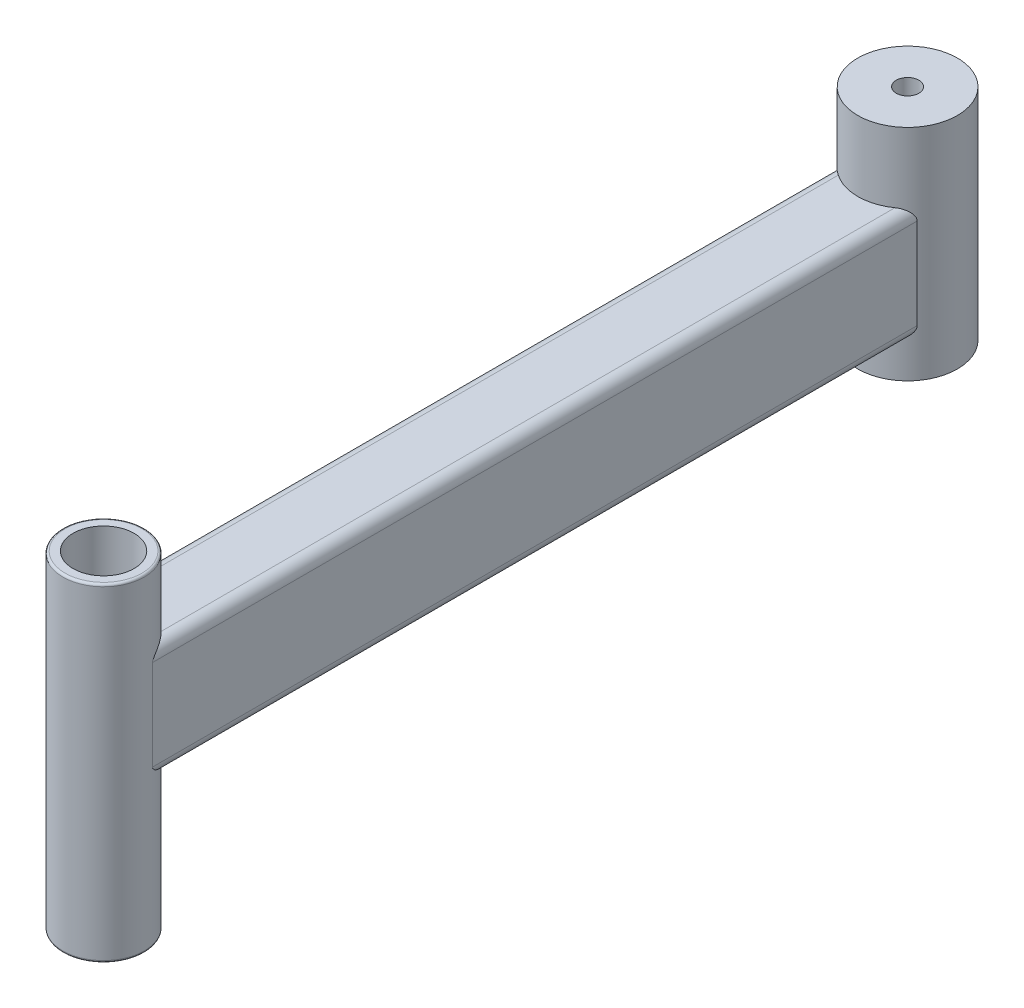
from build123d import *

# Parameters (mm, degrees)
SKETCH1_R                       = 22
BOSS_EXTRUDE1_DEPTH             = 97
SKETCH2_R                       = 5
CUT_EXTRUDE1_DEPTH              = 102.867561078
BOSS_EXTRUDE2_REACH             = 332.567
BOSS_EXTRUDE2_END_RADIUS        = 354
SKETCH6_W                       = 35
SKETCH6_H                       = 50
BOSS_EXTRUDE2_DIRECTION_2_DEPTH = 10
SKETCH7_R                       = 18
BOSS_EXTRUDE3_DEPTH             = 145
SKETCH8_R                       = 13.5
CUT_EXTRUDE2_DEPTH              = 401.960544509
FILLET1_R                       = 5
FILLET2_R                       = 1


with BuildPart() as part:
    # Sketch1 → Boss-Extrude1 (new body)
    with BuildSketch(Plane(origin=(0, 0, 0), x_dir=(1, 0, 0), z_dir=(0, 1, 0))):
        with Locations(Location((0, 0, 0), (0, 0, 270))):
            Circle(SKETCH1_R)
    extrude(amount=-BOSS_EXTRUDE1_DEPTH)

    # Sketch2 → Cut-Extrude1 (cut, through all)
    with BuildSketch(Plane(origin=(0, 0, 0), x_dir=(1, 0, 0), z_dir=(0, 1, 0))):
        with Locations(Location((0, 0, 0), (0, 0, 270))):
            Circle(SKETCH2_R)
    extrude(amount=-CUT_EXTRUDE1_DEPTH, mode=Mode.SUBTRACT)


with BuildPart() as body_2:
    # Boss-Extrude2: up to this cylinder (the profile starts inside it)
    boss_extrude2_end = Plane(origin=(0, -56, 0), z_dir=(0, 1, 0)) * Cylinder(BOSS_EXTRUDE2_END_RADIUS, 1374.134, mode=Mode.PRIVATE)
    # Sketch6 → Boss-Extrude2 (new, up to the surface)
    with BuildSketch(Plane.XY.offset(22), mode=Mode.PRIVATE) as boss_extrude2_sk1:
        with Locations((0, -56)):
            Rectangle(SKETCH6_W, SKETCH6_H)
    boss_extrude2_tool1 = extrude(boss_extrude2_sk1.sketch, amount=BOSS_EXTRUDE2_REACH, mode=Mode.PRIVATE) & boss_extrude2_end
    add(boss_extrude2_tool1.solids().sort_by_distance((0, -56, 22))[0])

    # Sketch6 → Boss-Extrude2 direction 2 (add)
    with BuildSketch(Plane.XY.offset(22)):
        with Locations((0, -56)):
            Rectangle(SKETCH6_W, SKETCH6_H)
    extrude(amount=-BOSS_EXTRUDE2_DIRECTION_2_DEPTH)


with BuildPart() as body_3:
    # Sketch7 → Boss-Extrude3 (new body)
    with BuildSketch(Plane(origin=(0, 0, 0), x_dir=(1, 0, 0), z_dir=(0, 1, 0))):
        with Locations(Location((0, -355.176041906, 0), (0, 0, 270))):
            Circle(SKETCH7_R)
    extrude(amount=-BOSS_EXTRUDE3_DEPTH)


with BuildPart() as cut_extrude2_tool:
    # Sketch8 → Cut-Extrude2 (new, through all)
    with BuildSketch(Plane(origin=(0, 0, 0), x_dir=(1, 0, 0), z_dir=(0, 1, 0))):
        with Locations(Location((0, -355.176041906, 0), (0, 0, 270))):
            Circle(SKETCH8_R)
    extrude(amount=-CUT_EXTRUDE2_DEPTH)


with BuildPart() as body_2_1:
    add(body_2.part)

    # Cut-Extrude2: cut by cut_extrude2_tool
    add(cut_extrude2_tool.part, mode=Mode.SUBTRACT)

    # Fillet1
    fillet1_edges = [body_2_1.edges().sort_by_distance(p)[0] for p in [
        (-17.5, -81, 182.783589453),
        (-17.5, -31, 182.783589453),
        (17.5, -31, 182.783589453),
        (17.5, -81, 182.783589453),
    ]]
    fillet(fillet1_edges, radius=FILLET1_R)


with BuildPart() as body_3_1:
    add(body_3.part)

    # Cut-Extrude2: cut by cut_extrude2_tool
    add(cut_extrude2_tool.part, mode=Mode.SUBTRACT)

    # Fillet2
    fillet2_edges = [body_3_1.edges().sort_by_distance(p)[0] for p in [
        (0, 0, 337.176041906),
        (0, -145, 337.176041906),
    ]]
    fillet(fillet2_edges, radius=FILLET2_R)


solid = Compound([part.part, body_2_1.part, body_3_1.part])
